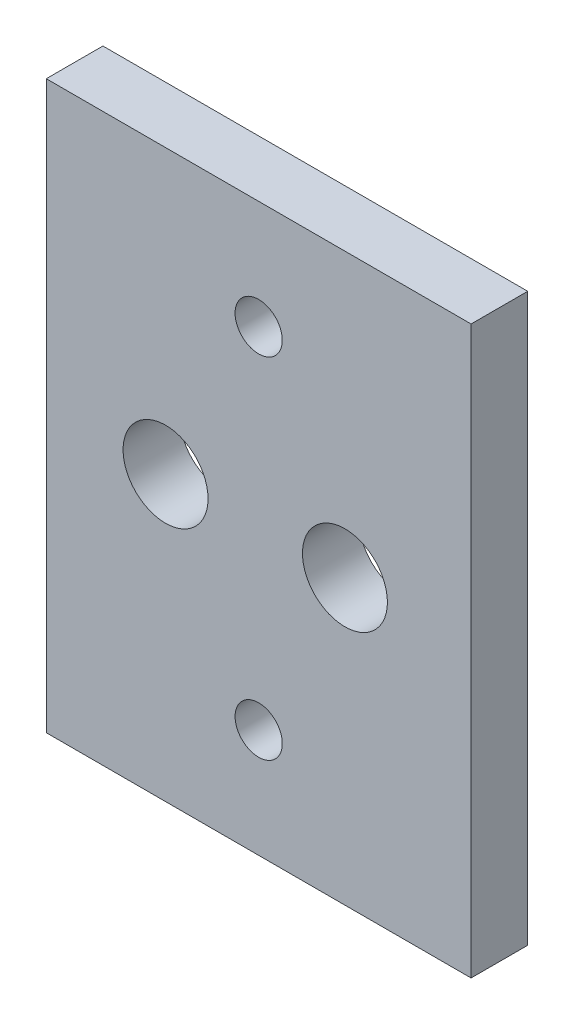
from build123d import *

# Parameters (mm, degrees)
SKETCH1_W           = 45
SKETCH1_H           = 60
SKETCH1_R           = 4.5
SKETCH1_R_2         = 2.5
BOSS_EXTRUDE1_DEPTH = 6


with BuildPart() as part:
    # Sketch1 → Boss-Extrude1 (new body)
    with BuildSketch(Plane(origin=(0, 0, 0), x_dir=(-1, 0, 0), z_dir=(0, 0, -1))):
        Rectangle(SKETCH1_W, SKETCH1_H)
        with Locations(Location((-9.137137395, 0.033994069, 0), (0, 0, 180))):
            Circle(SKETCH1_R, mode=Mode.SUBTRACT)
        with Locations((0, 18.5)):
            Circle(SKETCH1_R_2, mode=Mode.SUBTRACT)
        with Locations((0, -18.5)):
            Circle(SKETCH1_R_2, mode=Mode.SUBTRACT)
        with Locations(Location((9.862862605, 0.033994069, 0), (0, 0, 180))):
            Circle(SKETCH1_R, mode=Mode.SUBTRACT)
    extrude(amount=-BOSS_EXTRUDE1_DEPTH)


solid = part.part
